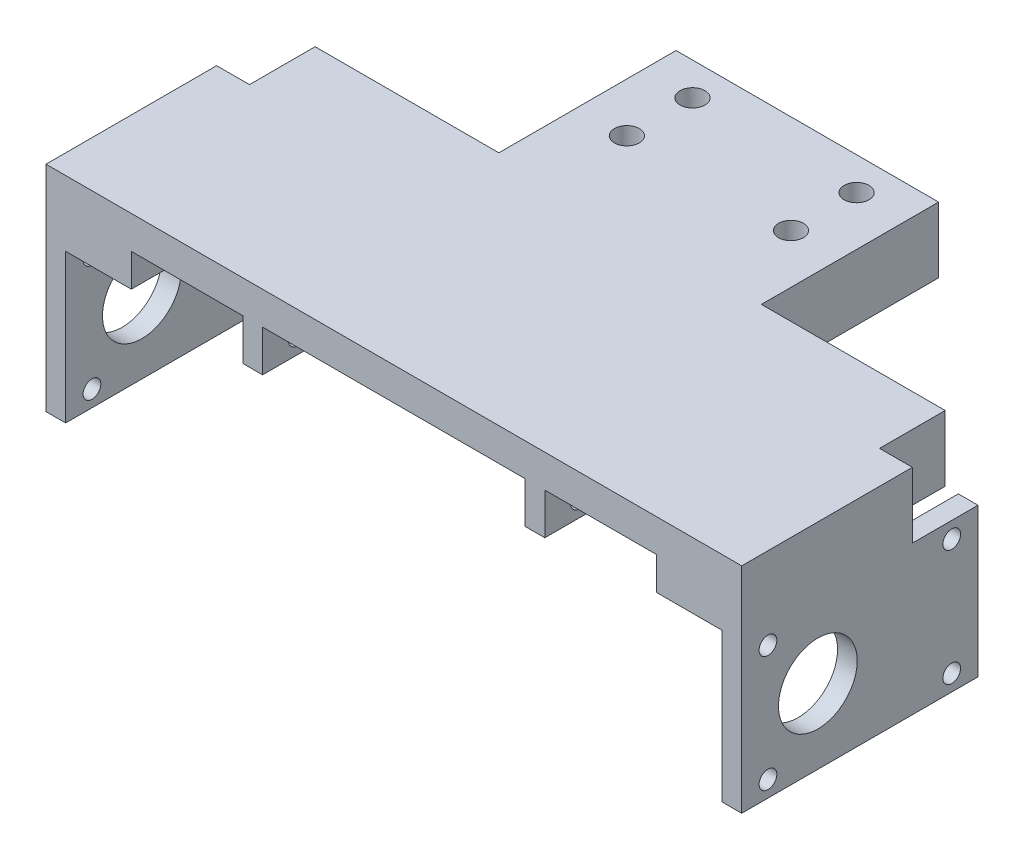
from build123d import *

# Parameters (mm, degrees)
SKETCH1_W           = 40
SKETCH1_H           = 27
SKETCH1_R           = 1.9
BOSS_EXTRUDE3_DEPTH = 10
SKETCH5_W           = 100
SKETCH5_H           = 36
BOSS_EXTRUDE4_DEPTH = 10
SKETCH6_W           = 36
SKETCH6_H           = 32.65
SKETCH6_R           = 1.35
SKETCH6_R_2         = 6
BOSS_EXTRUDE6_DEPTH = 3
SKETCH7_W           = 80
SKETCH7_H           = 10
CUT_EXTRUDE1_DEPTH  = 36
SKETCH8_W           = 3
SKETCH8_H           = 6.3
BOSS_EXTRUDE7_DEPTH = 21
SKETCH10_R          = 1.35
CUT_EXTRUDE3_DEPTH  = 46
SKETCH11_R          = 3.75
CUT_EXTRUDE4_DEPTH  = 1.5
SKETCH12_W          = 10
SKETCH12_H          = 10
CUT_EXTRUDE5_DEPTH  = 5


with BuildPart() as part:
    # Sketch1 → Boss-Extrude3 (new body)
    with BuildSketch(Plane(origin=(0, 0, 0), x_dir=(1, 0, 0), z_dir=(0, 1, 0))):
        with Locations((20, -13.5)):
            Rectangle(SKETCH1_W, SKETCH1_H)
        with Locations(Location((7.5, -5, 0), (0, 0, 270))):
            Circle(SKETCH1_R, mode=Mode.SUBTRACT)
        with Locations(Location((7.5, -15, 0), (0, 0, 270))):
            Circle(SKETCH1_R, mode=Mode.SUBTRACT)
        with Locations(Location((32.5, -15, 0), (0, 0, 90))):
            Circle(SKETCH1_R, mode=Mode.SUBTRACT)
        with Locations(Location((32.5, -5, 0), (0, 0, 90))):
            Circle(SKETCH1_R, mode=Mode.SUBTRACT)
    extrude(amount=BOSS_EXTRUDE3_DEPTH)

    # Sketch5 → Boss-Extrude4 (add)
    with BuildSketch(Plane(origin=(0, 10, 0), x_dir=(1, 0, 0), z_dir=(0, 1, 0))):
        with Locations((20, -45)):
            Rectangle(SKETCH5_W, SKETCH5_H)
    extrude(amount=-BOSS_EXTRUDE4_DEPTH)

    # Sketch6 → Boss-Extrude6 (add)
    with BuildSketch(Plane(origin=(70, 0, 0), x_dir=(0, 0, -1), z_dir=(1, 0, 0))):
        with Locations((-45, -6.325)):
            Rectangle(SKETCH6_W, SKETCH6_H)
        with Locations((-59, -20.175)):
            Circle(SKETCH6_R, mode=Mode.SUBTRACT)
        with Locations((-59, -2.475)):
            Circle(SKETCH6_R, mode=Mode.SUBTRACT)
        with Locations(Location((-31, -20.175, 0), (0, 0, 180))):
            Circle(SKETCH6_R, mode=Mode.SUBTRACT)
        with Locations(Location((-31, -2.475, 0), (0, 0, 180))):
            Circle(SKETCH6_R, mode=Mode.SUBTRACT)
        with Locations((-51.4, -11.325)):
            Circle(SKETCH6_R_2, mode=Mode.SUBTRACT)
    boss_extrude6 = extrude(amount=BOSS_EXTRUDE6_DEPTH)

    # Mirror1: Boss-Extrude6 across plane
    add(boss_extrude6.mirror(Plane(origin=(20, 0, 0), x_dir=(0, 0, 1), z_dir=(1, 0, 0))))

    # Sketch7 → Cut-Extrude1 (cut)
    with BuildSketch(Plane.XY.offset(63)):
        with Locations((20, 0)):
            Rectangle(SKETCH7_W, SKETCH7_H)
    extrude(amount=-CUT_EXTRUDE1_DEPTH, mode=Mode.SUBTRACT)

    # Sketch8 → Boss-Extrude7 (add)
    with BuildSketch(Plane.XY.offset(63)):
        with Locations((-1.5, 1.85)):
            Rectangle(SKETCH8_W, SKETCH8_H)
    boss_extrude7 = extrude(amount=-BOSS_EXTRUDE7_DEPTH)

    # Mirror2: Boss-Extrude7 across plane
    add(boss_extrude7.mirror(Plane(origin=(20, 0, 0), x_dir=(0, 0, 1), z_dir=(1, 0, 0))))

    # Sketch10 → Cut-Extrude3 (cut)
    with BuildSketch(Plane.ZY.offset(3)):
        with Locations(Location((57.7, 1.23, 0), (0, 0, 270))):
            Circle(SKETCH10_R)
        with Locations(Location((45.1, 1.23, 0), (0, 0, 180))):
            Circle(SKETCH10_R)
    extrude(amount=-CUT_EXTRUDE3_DEPTH, mode=Mode.SUBTRACT)

    # Sketch11 → Cut-Extrude4 (cut)
    with BuildSketch(Plane(origin=(-30, 0, 0), x_dir=(0, 0, -1), z_dir=(1, 0, 0))):
        with Locations((-39.95, -11.325)):
            Circle(SKETCH11_R)
    cut_extrude4 = extrude(amount=-CUT_EXTRUDE4_DEPTH, mode=Mode.SUBTRACT)

    # Mirror3: Cut-Extrude4 across plane
    add(cut_extrude4.mirror(Plane(origin=(20, 0, 0), x_dir=(0, 0, 1), z_dir=(1, 0, 0))), mode=Mode.SUBTRACT)

    # Sketch12 → Cut-Extrude5 (cut)
    with BuildSketch(Plane(origin=(73, 0, 0), x_dir=(0, 0, -1), z_dir=(1, 0, 0))):
        with Locations((-32, 5)):
            Rectangle(SKETCH12_W, SKETCH12_H)
    cut_extrude5 = extrude(amount=-CUT_EXTRUDE5_DEPTH, mode=Mode.SUBTRACT)

    # Mirror4: Cut-Extrude5 across plane
    add(cut_extrude5.mirror(Plane(origin=(20, 0, 0), x_dir=(0, 0, 1), z_dir=(1, 0, 0))), mode=Mode.SUBTRACT)


solid = part.part
